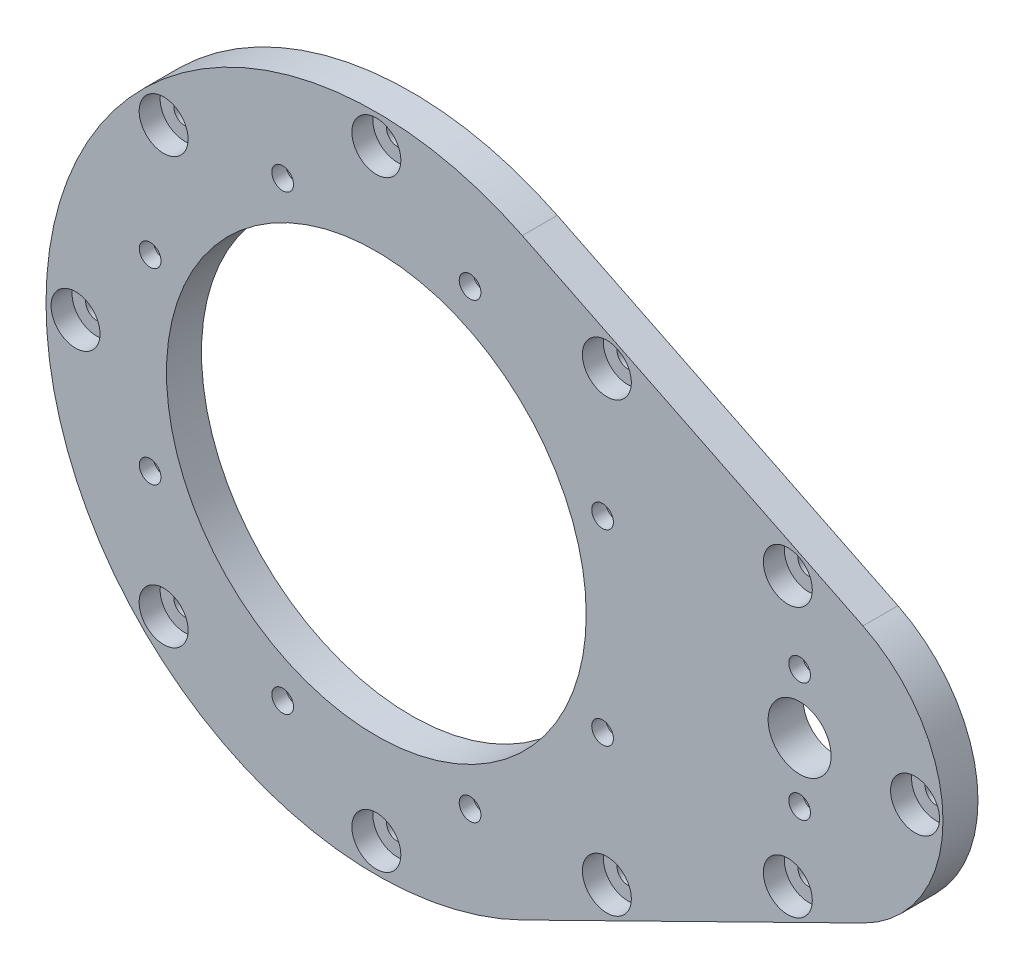
from build123d import *

# Parameters (mm, degrees)
SKETCH1_R           = 1.55
SKETCH1_R_2         = 4.5
SKETCH1_R_3         = 30
BOSS_EXTRUDE2_DEPTH = 5
SKETCH2_R           = 3.5
CUT_EXTRUDE1_DEPTH  = 3
SKETCH3_R           = 3.5
CUT_EXTRUDE2_DEPTH  = 3


with BuildPart() as part:
    # Sketch1 → Boss-Extrude2 (new body)
    with BuildSketch(Plane.XY):
        with BuildLine():
            Line((69.554166667, 18.392174041), (20.855868056, 42.36555049))
            ThreePointArc((20.855868056, 42.36555049), (-47.220833333, 0), (20.855868056, -42.36555049))
            Line((20.855868056, -42.36555049), (69.554166667, -18.392174041))
            ThreePointArc((69.554166667, -18.392174041), (81, 0), (69.554166667, 18.392174041))
        make_face()
        with Locations((60.5, 8.5)):
            Circle(SKETCH1_R, mode=Mode.SUBTRACT)
        with Locations((60.5, -8.5)):
            Circle(SKETCH1_R, mode=Mode.SUBTRACT)
        with Locations((60.5, 0)):
            Circle(SKETCH1_R_2, mode=Mode.SUBTRACT)
        Circle(SKETCH1_R_3, mode=Mode.SUBTRACT)
        with Locations((0, 43)):
            Circle(SKETCH1_R, mode=Mode.SUBTRACT)
        with Locations((-30.405591591, 30.405591591)):
            Circle(SKETCH1_R, mode=Mode.SUBTRACT)
        with Locations((-43, 0)):
            Circle(SKETCH1_R, mode=Mode.SUBTRACT)
        with Locations((-30.405591591, -30.405591591)):
            Circle(SKETCH1_R, mode=Mode.SUBTRACT)
        with Locations((0, -43)):
            Circle(SKETCH1_R, mode=Mode.SUBTRACT)
        with Locations((32.335783638, 13.393920133)):
            Circle(SKETCH1_R, mode=Mode.SUBTRACT)
        with Locations((32.335783638, -13.393920133)):
            Circle(SKETCH1_R, mode=Mode.SUBTRACT)
        with Locations((13.393920133, -32.335783638)):
            Circle(SKETCH1_R, mode=Mode.SUBTRACT)
        with Locations((-13.393920133, -32.335783638)):
            Circle(SKETCH1_R, mode=Mode.SUBTRACT)
        with Locations((-32.335783638, -13.393920133)):
            Circle(SKETCH1_R, mode=Mode.SUBTRACT)
        with Locations((-32.335783638, 13.393920133)):
            Circle(SKETCH1_R, mode=Mode.SUBTRACT)
        with Locations((-13.393920133, 32.335783638)):
            Circle(SKETCH1_R, mode=Mode.SUBTRACT)
        with Locations((13.393920133, 32.335783638)):
            Circle(SKETCH1_R, mode=Mode.SUBTRACT)
        with Locations((32.94935499, 31.953706526)):
            Circle(SKETCH1_R, mode=Mode.SUBTRACT)
        with Locations((58.815707785, 19.220123822)):
            Circle(SKETCH1_R, mode=Mode.SUBTRACT)
        with Locations((32.94935499, -31.953706526)):
            Circle(SKETCH1_R, mode=Mode.SUBTRACT)
        with Locations((58.815707785, -19.220123822)):
            Circle(SKETCH1_R, mode=Mode.SUBTRACT)
        with Locations((77, 0)):
            Circle(SKETCH1_R, mode=Mode.SUBTRACT)
    extrude(amount=BOSS_EXTRUDE2_DEPTH)

    # Sketch2 → Cut-Extrude1 (cut)
    with BuildSketch(Plane(origin=(0, 0, 0), x_dir=(-1, 0, 0), z_dir=(0, 0, -1))):
        with Locations((-60.5, 8.5)):
            Circle(SKETCH2_R)
        with Locations((-60.5, -8.5)):
            Circle(SKETCH2_R)
        with Locations((-13.393920133, 32.335783638)):
            Circle(SKETCH2_R)
        with Locations((13.393920133, 32.335783638)):
            Circle(SKETCH2_R)
        with Locations((32.335783638, 13.393920133)):
            Circle(SKETCH2_R)
        with Locations((32.335783638, -13.393920133)):
            Circle(SKETCH2_R)
        with Locations((13.393920133, -32.335783638)):
            Circle(SKETCH2_R)
        with Locations((-13.393920133, -32.335783638)):
            Circle(SKETCH2_R)
        with Locations((-32.335783638, -13.393920133)):
            Circle(SKETCH2_R)
        with Locations((-32.335783638, 13.393920133)):
            Circle(SKETCH2_R)
    extrude(amount=-CUT_EXTRUDE1_DEPTH, mode=Mode.SUBTRACT)

    # Sketch3 → Cut-Extrude2 (cut)
    with BuildSketch(Plane.XY.offset(5)):
        with Locations((0, 43)):
            Circle(SKETCH3_R)
        with Locations((-30.405591591, 30.405591591)):
            Circle(SKETCH3_R)
        with Locations((-43, 0)):
            Circle(SKETCH3_R)
        with Locations((-30.405591591, -30.405591591)):
            Circle(SKETCH3_R)
        with Locations((0, -43)):
            Circle(SKETCH3_R)
        with Locations((32.94935499, 31.953706526)):
            Circle(SKETCH3_R)
        with Locations((58.815707785, 19.220123822)):
            Circle(SKETCH3_R)
        with Locations((32.94935499, -31.953706526)):
            Circle(SKETCH3_R)
        with Locations((58.815707785, -19.220123822)):
            Circle(SKETCH3_R)
        with Locations((77, 0)):
            Circle(SKETCH3_R)
    extrude(amount=-CUT_EXTRUDE2_DEPTH, mode=Mode.SUBTRACT)


solid = part.part
